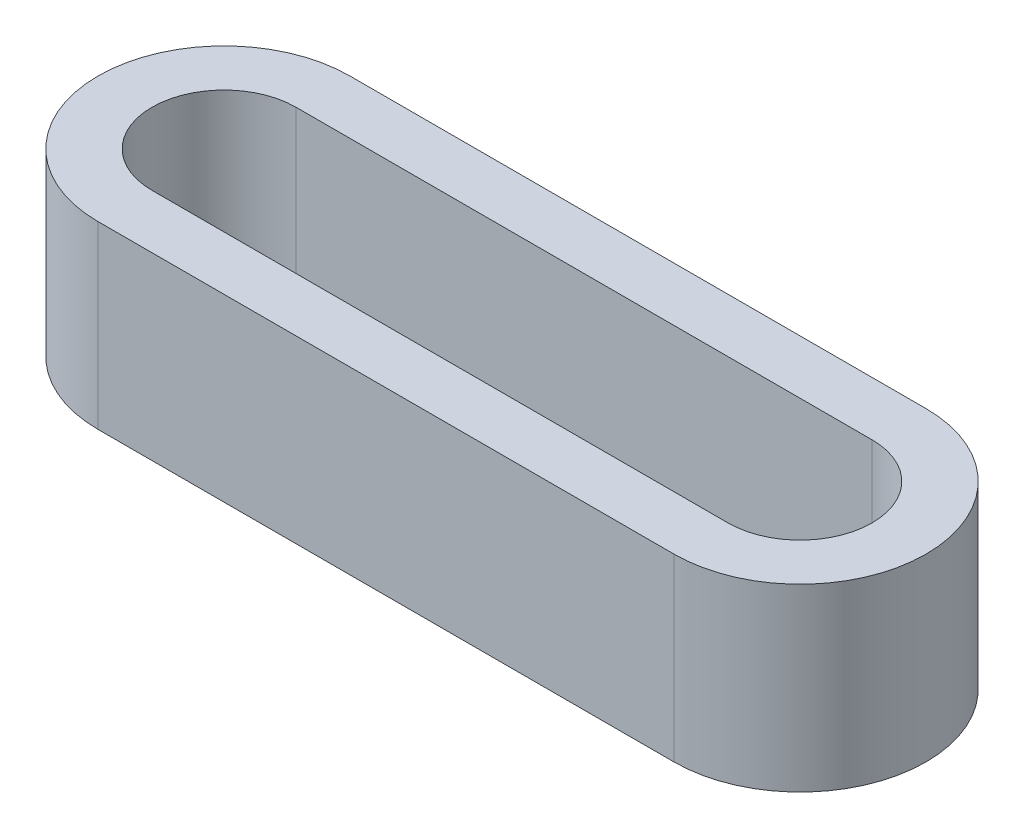
from build123d import *

# Parameters (mm, degrees)
DODANIE_WYCI_GNI_CIE1_DEPTH = 10


with BuildPart() as part:
    # Szkic2 → Dodanie-wyciągnięcie1 (new body)
    with BuildSketch(Plane(origin=(0, 0, 0), x_dir=(1, 0, 0), z_dir=(0, 1, 0))):
        with BuildLine():
            Line((0, 7), (32, 7))
            ThreePointArc((32, 7), (39, 0), (32, -7))
            Line((32, -7), (0, -7))
            ThreePointArc((0, -7), (-7, 0), (0, 7))
        make_face()
        with BuildLine():
            Line((0, 4), (32, 4))
            ThreePointArc((32, 4), (36, 0), (32, -4))
            Line((32, -4), (0, -4))
            ThreePointArc((0, -4), (-4, 0), (0, 4))
        make_face(mode=Mode.SUBTRACT)
    extrude(amount=DODANIE_WYCI_GNI_CIE1_DEPTH)


solid = part.part
